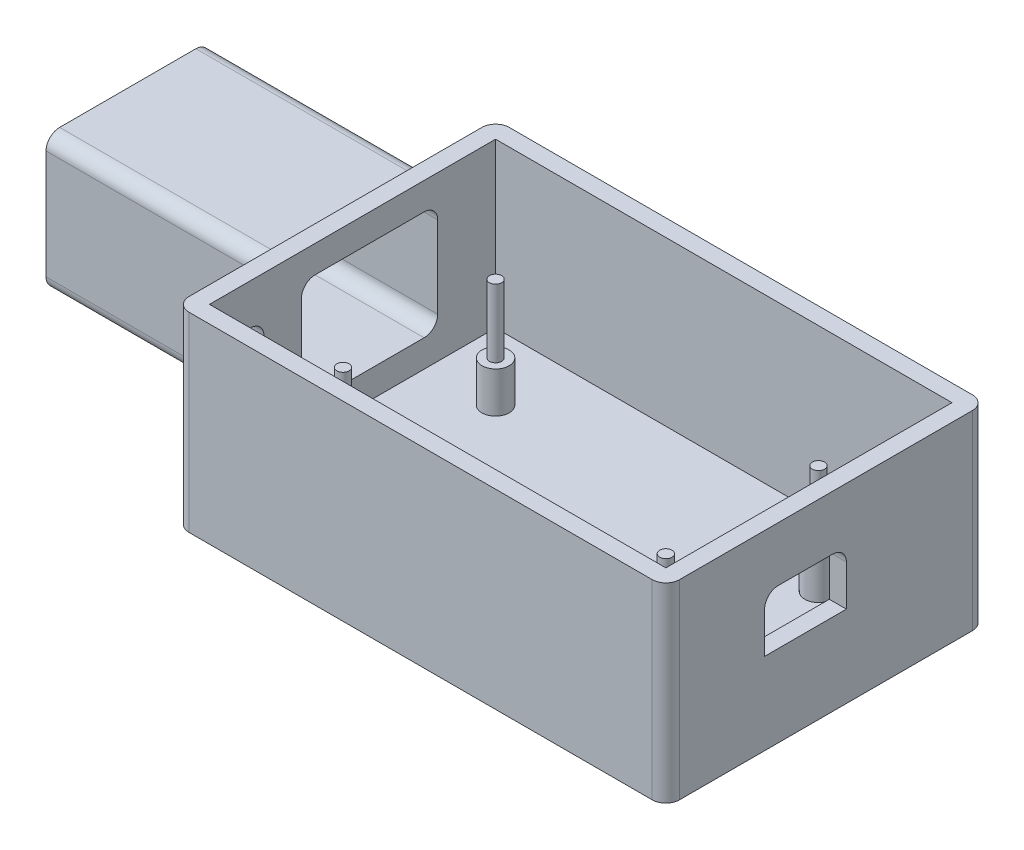
from build123d import *

# Parameters (mm, degrees)
SKETCH1_W           = 72
SKETCH1_H           = 47
BOSS_EXTRUDE1_DEPTH = 4
SKETCH3_W           = 72
SKETCH3_H           = 47
SKETCH3_W_2         = 67
SKETCH3_H_2         = 42
BOSS_EXTRUDE3_DEPTH = 24
SKETCH2_R           = 0.9
BOSS_EXTRUDE4_DEPTH = 16
SKETCH4_R           = 2
BOSS_EXTRUDE5_DEPTH = 6
SKETCH5_W           = 12
SKETCH5_H           = 8
CUT_EXTRUDE1_DEPTH  = 6
FILLET2_R           = 2
FILLET3_R           = 2
SKETCH11_W          = 24
SKETCH11_H          = 20
BOSS_EXTRUDE7_DEPTH = 33
SKETCH12_W          = 20
SKETCH12_H          = 16
CUT_EXTRUDE4_DEPTH  = 20
SKETCH13_W          = 15
SKETCH13_H          = 9
CUT_EXTRUDE5_DEPTH  = 20
FILLET4_R           = 2
FILLET5_R           = 2
SKETCH14_W          = 6
SKETCH14_H          = 14
CUT_EXTRUDE6_DEPTH  = 5
FILLET6_R           = 2


with BuildPart() as part:
    # Sketch1 → Boss-Extrude1 (new body)
    with BuildSketch(Plane(origin=(0, 0, 0), x_dir=(1, 0, 0), z_dir=(0, 1, 0))):
        with Locations((25.5, 13)):
            Rectangle(SKETCH1_W, SKETCH1_H)
    extrude(amount=BOSS_EXTRUDE1_DEPTH)

    # Sketch3 → Boss-Extrude3 (add)
    with BuildSketch(Plane(origin=(0, 4, 0), x_dir=(1, 0, 0), z_dir=(0, 1, 0))):
        with Locations((25.5, 13)):
            Rectangle(SKETCH3_W, SKETCH3_H)
        with Locations((25.5, 13)):
            Rectangle(SKETCH3_W_2, SKETCH3_H_2, mode=Mode.SUBTRACT)
    extrude(amount=BOSS_EXTRUDE3_DEPTH)

    # Sketch2 → Boss-Extrude4 (add)
    with BuildSketch(Plane(origin=(0, 4, 0), x_dir=(1, 0, 0), z_dir=(0, 1, 0))):
        with Locations(Location((1.8, 24.2, 0), (0, 0, 270))):
            Circle(SKETCH2_R)
        with Locations(Location((1.8, 1.8, 0), (0, 0, 90))):
            Circle(SKETCH2_R)
        with Locations(Location((49.2, 1.8, 0), (0, 0, 270))):
            Circle(SKETCH2_R)
        with Locations(Location((49.2, 24.2, 0), (0, 0, 90))):
            Circle(SKETCH2_R)
    extrude(amount=BOSS_EXTRUDE4_DEPTH)

    # Sketch4 → Boss-Extrude5 (add)
    with BuildSketch(Plane(origin=(0, 4, 0), x_dir=(1, 0, 0), z_dir=(0, 1, 0))):
        with Locations(Location((1.8, 24.2, 0), (0, 0, 270))):
            Circle(SKETCH4_R)
        with Locations(Location((1.8, 1.8, 0), (0, 0, 90))):
            Circle(SKETCH4_R)
        with Locations(Location((49.2, 1.8, 0), (0, 0, 270))):
            Circle(SKETCH4_R)
        with Locations(Location((49.2, 24.2, 0), (0, 0, 90))):
            Circle(SKETCH4_R)
    extrude(amount=BOSS_EXTRUDE5_DEPTH)

    # Sketch5 → Cut-Extrude1 (cut)
    with BuildSketch(Plane(origin=(61.5, 0, 0), x_dir=(0, 0, -1), z_dir=(1, 0, 0))):
        with Locations((10, 16)):
            Rectangle(SKETCH5_W, SKETCH5_H)
    extrude(amount=-CUT_EXTRUDE1_DEPTH, mode=Mode.SUBTRACT)

    # Fillet2
    fillet2_edges = [part.edges().sort_by_distance(p)[0] for p in [
        (-10.5, 14, 10.5),
        (-10.5, 14, -36.5),
        (61.5, 14, -36.5),
        (61.5, 14, 10.5),
    ]]
    fillet(fillet2_edges, radius=FILLET2_R)

    # Fillet3
    fillet3_edges = [part.edges().sort_by_distance(p)[0] for p in [
        (60.25, 20, -4),
        (60.25, 20, -16),
    ]]
    fillet(fillet3_edges, radius=FILLET3_R)

    # Sketch11 → Boss-Extrude7 (add)
    with BuildSketch(Plane.ZY.offset(10.5)):
        with Locations((-15.5, 16)):
            Rectangle(SKETCH11_W, SKETCH11_H)
    extrude(amount=BOSS_EXTRUDE7_DEPTH)

    # Sketch12 → Cut-Extrude4 (cut)
    with BuildSketch(Plane(origin=(-8, 0, 0), x_dir=(0, 0, -1), z_dir=(1, 0, 0))):
        with Locations((15.5, 16)):
            Rectangle(SKETCH12_W, SKETCH12_H)
    extrude(amount=-CUT_EXTRUDE4_DEPTH, mode=Mode.SUBTRACT)

    # Sketch13 → Cut-Extrude5 (cut)
    with BuildSketch(Plane.ZY.offset(43.5)):
        with Locations((-15.5, 16)):
            Rectangle(SKETCH13_W, SKETCH13_H)
    extrude(amount=-CUT_EXTRUDE5_DEPTH, mode=Mode.SUBTRACT)

    # Fillet4
    fillet4_edges = [part.edges().sort_by_distance(p)[0] for p in [
        (-18, 8, -25.5),
        (-18, 8, -5.5),
        (-18, 24, -5.5),
        (-18, 24, -25.5),
    ]]
    fillet(fillet4_edges, radius=FILLET4_R)

    # Fillet5
    fillet5_edges = [part.edges().sort_by_distance(p)[0] for p in [
        (-27, 26, -27.5),
        (-27, 6, -27.5),
        (-27, 6, -3.5),
        (-27, 26, -3.5),
    ]]
    fillet(fillet5_edges, radius=FILLET5_R)

    # Sketch14 → Cut-Extrude6 (cut)
    with BuildSketch(Plane.ZY.offset(10.5)):
        with Locations((3, 15)):
            Rectangle(SKETCH14_W, SKETCH14_H)
    extrude(amount=-CUT_EXTRUDE6_DEPTH, mode=Mode.SUBTRACT)

    # Fillet6
    fillet6_edges = [part.edges().sort_by_distance(p)[0] for p in [
        (-9.25, 8, 0),
        (-9.25, 22, 0),
        (-9.25, 22, 6),
        (-9.25, 8, 6),
    ]]
    fillet(fillet6_edges, radius=FILLET6_R)


solid = part.part
